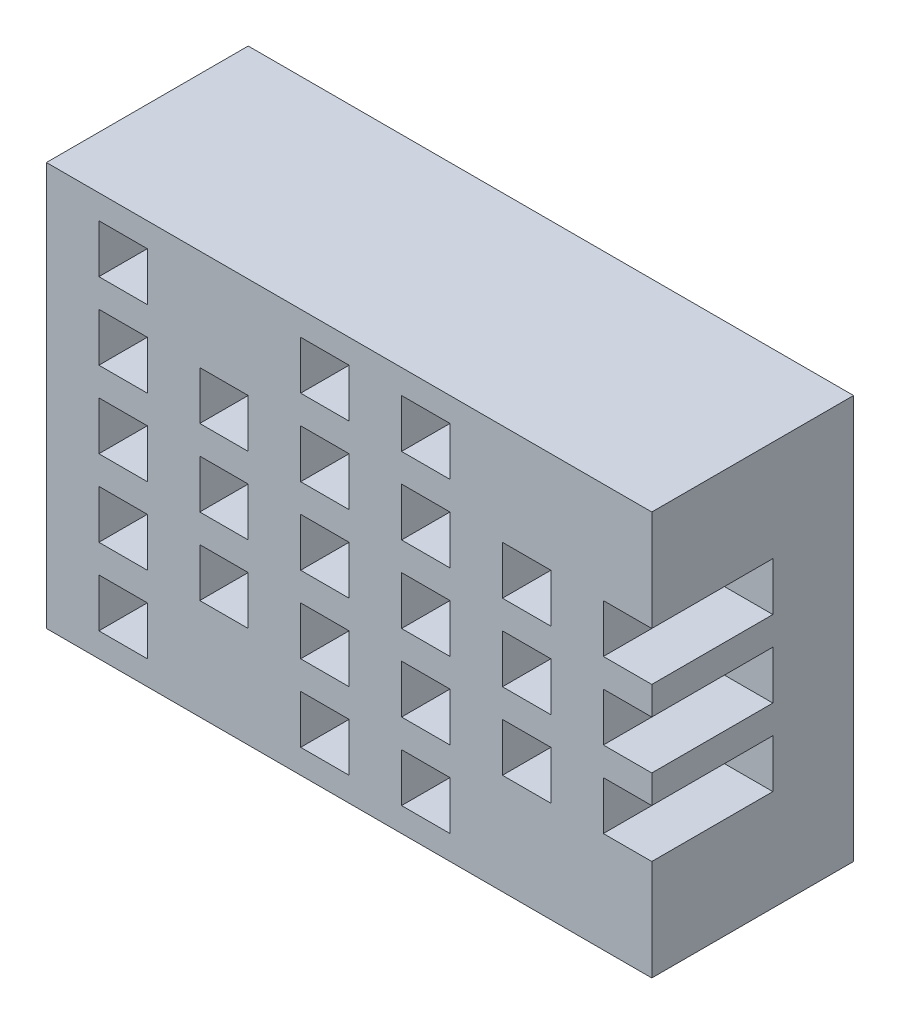
from build123d import *

# Parameters (mm, degrees)
SKETCH_1_W          = 15
SKETCH_1_H          = 10
EXTRUDE_1_DEPTH     = 5
SKETCH_2_W          = 1.2
SKETCH_2_H          = 1.2
CUT_EXTRUDE_1_DEPTH = 3


with BuildPart() as part:
    # 草图1 → 凸台-拉伸1 (new body)
    with BuildSketch(Plane.XY):
        with Locations((7.5, -5)):
            Rectangle(SKETCH_1_W, SKETCH_1_H)
    extrude(amount=EXTRUDE_1_DEPTH)

    # 草图2 → 切除-拉伸1 (cut)
    with BuildSketch(Plane.XY.offset(5)):
        with Locations((1.9, -1.2)):
            Rectangle(SKETCH_2_W, SKETCH_2_H)
        with Locations((1.9, -3.1)):
            Rectangle(SKETCH_2_W, SKETCH_2_H)
        with Locations((1.9, -5)):
            Rectangle(SKETCH_2_W, SKETCH_2_H)
        with Locations((1.9, -6.9)):
            Rectangle(SKETCH_2_W, SKETCH_2_H)
        with Locations((1.9, -8.8)):
            Rectangle(SKETCH_2_W, SKETCH_2_H)
        with Locations((4.4, -3.1)):
            Rectangle(SKETCH_2_W, SKETCH_2_H)
        with Locations((6.9, -3.1)):
            Rectangle(SKETCH_2_W, SKETCH_2_H)
        with Locations((11.9, -3.1)):
            Rectangle(SKETCH_2_W, SKETCH_2_H)
        with Locations((9.4, -3.1)):
            Rectangle(SKETCH_2_W, SKETCH_2_H)
        with Locations((14.4, -3.1)):
            Rectangle(SKETCH_2_W, SKETCH_2_H)
        with Locations((4.4, -5)):
            Rectangle(SKETCH_2_W, SKETCH_2_H)
        with Locations((6.9, -5)):
            Rectangle(SKETCH_2_W, SKETCH_2_H)
        with Locations((9.4, -5)):
            Rectangle(SKETCH_2_W, SKETCH_2_H)
        with Locations((11.9, -5)):
            Rectangle(SKETCH_2_W, SKETCH_2_H)
        with Locations((14.4, -5)):
            Rectangle(SKETCH_2_W, SKETCH_2_H)
        with Locations((4.4, -6.9)):
            Rectangle(SKETCH_2_W, SKETCH_2_H)
        with Locations((6.9, -6.9)):
            Rectangle(SKETCH_2_W, SKETCH_2_H)
        with Locations((9.4, -6.9)):
            Rectangle(SKETCH_2_W, SKETCH_2_H)
        with Locations((11.9, -6.9)):
            Rectangle(SKETCH_2_W, SKETCH_2_H)
        with Locations((14.4, -6.9)):
            Rectangle(SKETCH_2_W, SKETCH_2_H)
        with Locations((6.9, -8.8)):
            Rectangle(SKETCH_2_W, SKETCH_2_H)
        with Locations((9.4, -8.8)):
            Rectangle(SKETCH_2_W, SKETCH_2_H)
        with Locations((6.9, -1.2)):
            Rectangle(SKETCH_2_W, SKETCH_2_H)
        with Locations((9.4, -1.2)):
            Rectangle(SKETCH_2_W, SKETCH_2_H)
    extrude(amount=-CUT_EXTRUDE_1_DEPTH, mode=Mode.SUBTRACT)


solid = part.part
